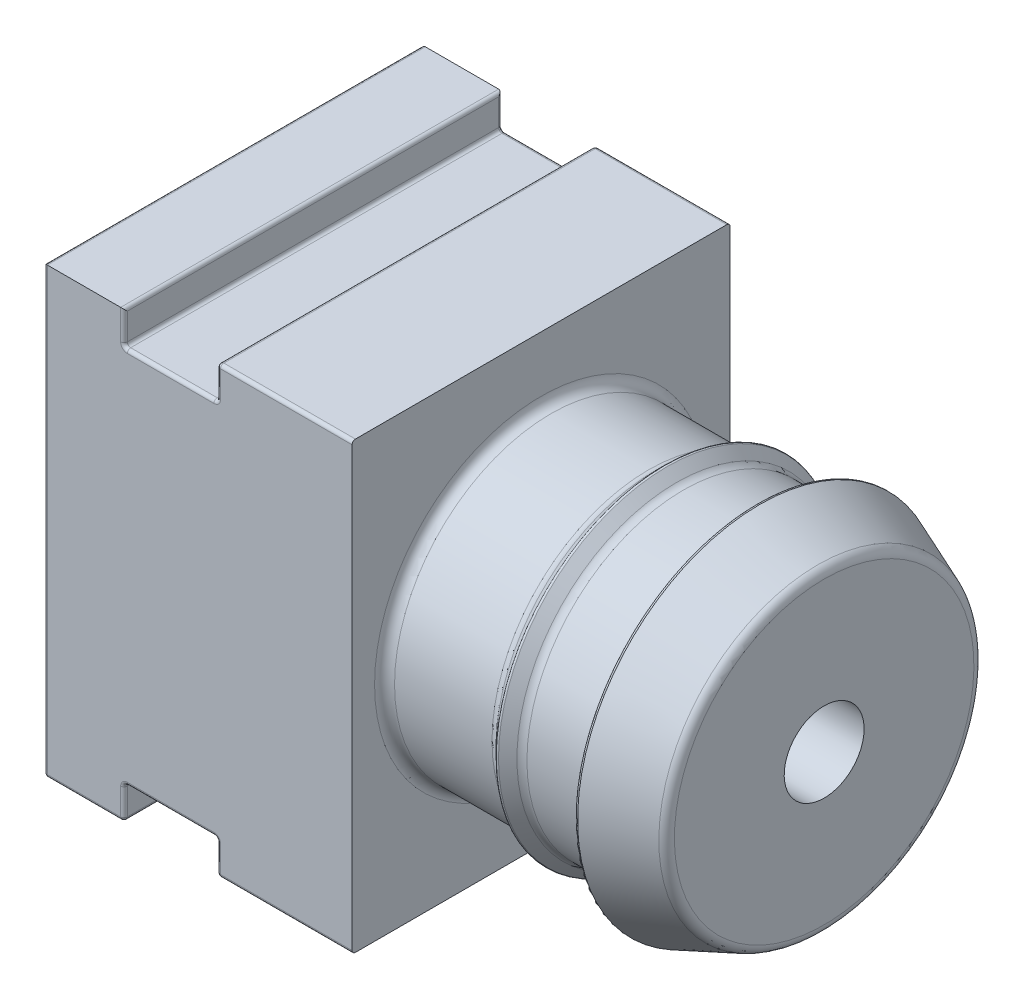
from build123d import *

# Parameters (mm, degrees)
SKETCH2_W                  = 18.5
SKETCH2_H                  = 22.7
SKETCH2_R                  = 3.175
BOSS_EXTRUDE2_DEPTH        = 11.35
F_10_32_TAPPED_HOLE1_D     = 4.0386
F_10_32_TAPPED_HOLE1_DEPTH = 13.75
F_10_32_TAPPED_HOLE1_TIP   = 1.213317848
SKETCH18_R                 = 2.4
CUT_EXTRUDE2_DEPTH         = 22
SKETCH12_R                 = 3.175
BOSS_EXTRUDE3_DEPTH        = 22.7
SKETCH13_W                 = 18.5
SKETCH13_H                 = 22.7
BOSS_EXTRUDE4_DEPTH        = 2
SKETCH15_W                 = 5.6
SKETCH15_H                 = 2
CUT_EXTRUDE1_DEPTH         = 33.183264284
FILLET1_R                  = 0.1
FILLET2_R                  = 0.6
FILLET5_R                  = 0.2


with BuildPart() as part:
    # Sketch2 → Boss-Extrude2 (new, symmetric)
    with BuildSketch(Plane(origin=(0, 0, 0), x_dir=(1, 0, 0), z_dir=(0, 1, 0))):
        with Locations((-9.25, 0)):
            Rectangle(SKETCH2_W, SKETCH2_H)
        with Locations(Location((-12.7, 0, 0), (0, 0, 270))):
            Circle(SKETCH2_R, mode=Mode.SUBTRACT)
    extrude(amount=BOSS_EXTRUDE2_DEPTH, both=True)

    # #10-32 Tapped Hole1
    with Locations(Plane(origin=(0, 0, -11.35), x_dir=(-1, 0, 0), z_dir=(0, 0, -1))):
        with Locations((4.8, 0)):
            Hole(F_10_32_TAPPED_HOLE1_D / 2, depth=F_10_32_TAPPED_HOLE1_DEPTH)
            with Locations((0, 0, -(F_10_32_TAPPED_HOLE1_DEPTH + F_10_32_TAPPED_HOLE1_TIP / 2))):  # 118° drill point
                Cone(0, F_10_32_TAPPED_HOLE1_D / 2, F_10_32_TAPPED_HOLE1_TIP, mode=Mode.SUBTRACT)

    # Sketch3 → Revolve1 (revolve)
    with BuildSketch(Plane.XY):
        Polygon((0, 0), (0, 9.4), (6.7, 9.4), (7.5, 10.2), (8.3, 9.4), (13, 9.4), (13, 11), (17, 9.4), (17, 0), align=None)
    revolve(axis=Axis((17, 0, 0), (-1, 0, 0)))

    # Sketch18 → Cut-Extrude2 (cut)
    with BuildSketch(Plane(origin=(17, 0, 0), x_dir=(0, 0, -1), z_dir=(1, 0, 0))):
        with Locations(Location((0, 0, 0), (0, 0, 90))):
            Circle(SKETCH18_R)
    extrude(amount=-CUT_EXTRUDE2_DEPTH, mode=Mode.SUBTRACT)

    # Sketch12 → Boss-Extrude3 (add)
    with BuildSketch(Plane.XZ.offset(11.35)):
        with Locations((-12.7, 0)):
            Circle(SKETCH12_R)
    extrude(amount=-BOSS_EXTRUDE3_DEPTH)

    # Sketch13 → Boss-Extrude4 (add)
    with BuildSketch(Plane.XZ.offset(11.35)):
        with Locations((-9.25, 0)):
            Rectangle(SKETCH13_W, SKETCH13_H)
    boss_extrude4 = extrude(amount=BOSS_EXTRUDE4_DEPTH)

    # Mirror1: Boss-Extrude4 across plane
    add(boss_extrude4.mirror(Plane.ZX))

    # Sketch15 → Cut-Extrude1 (cut, through all)
    with BuildSketch(Plane(origin=(0, 0, -11.35), x_dir=(-1, 0, 0), z_dir=(0, 0, -1))):
        with Locations((10.9, 12.35)):
            Rectangle(SKETCH15_W, SKETCH15_H)
        with Locations((10.9, -12.35)):
            Rectangle(SKETCH15_W, SKETCH15_H)
    extrude(amount=-CUT_EXTRUDE1_DEPTH, mode=Mode.SUBTRACT)

    # Fillet1
    fillet1_edges = [part.edges().sort_by_distance(p)[0] for p in [
        (13, -11, 0),
        (7.5, -10.2, 0),
    ]]
    fillet(fillet1_edges, radius=FILLET1_R)

    # Fillet2
    fillet2_edges = [part.edges().sort_by_distance(p)[0] for p in [
        (0, -9.4, 0),
        (8.3, -9.4, 0),
        (13, -9.4, 0),
        (17, -9.4, 0),
        (6.7, -9.4, 0),
    ]]
    fillet(fillet2_edges, radius=FILLET2_R)

    # Fillet5
    fillet5_edges = [part.edges().sort_by_distance(p)[0] for p in [
        (-4.05, -13.35, 11.35),
        (-18.5, -13.35, 0),
        (-16.1, -13.35, -11.35),
        (-18.5, 13.35, 0),
        (-4.05, 13.35, 11.35),
        (-4.05, 13.35, -11.35),
        (-16.1, -13.35, 11.35),
        (-4.05, -13.35, -11.35),
        (-18.5, 0, 11.35),
        (-18.5, 0, -11.35),
        (-8.1, 12.35, 11.35),
        (-8.1, 11.35, 0),
        (-8.1, 13.35, 0),
        (-13.7, 12.35, 11.35),
        (-13.7, 13.35, 0),
        (-10.9, 11.35, 11.35),
        (-13.7, 11.35, 0),
        (-8.1, 12.35, -11.35),
        (-10.9, 11.35, -11.35),
        (-13.7, 12.35, -11.35),
        (-13.7, -13.35, 0),
        (-8.1, -12.35, 11.35),
        (-8.1, -13.35, 0),
        (-10.9, -11.35, 11.35),
        (-8.1, -11.35, 0),
        (-13.7, -12.35, 11.35),
        (-13.7, -11.35, 0),
        (-13.7, -12.35, -11.35),
        (-10.9, -11.35, -11.35),
        (-8.1, -12.35, -11.35),
    ]]
    fillet(fillet5_edges, radius=FILLET5_R)


solid = part.part
